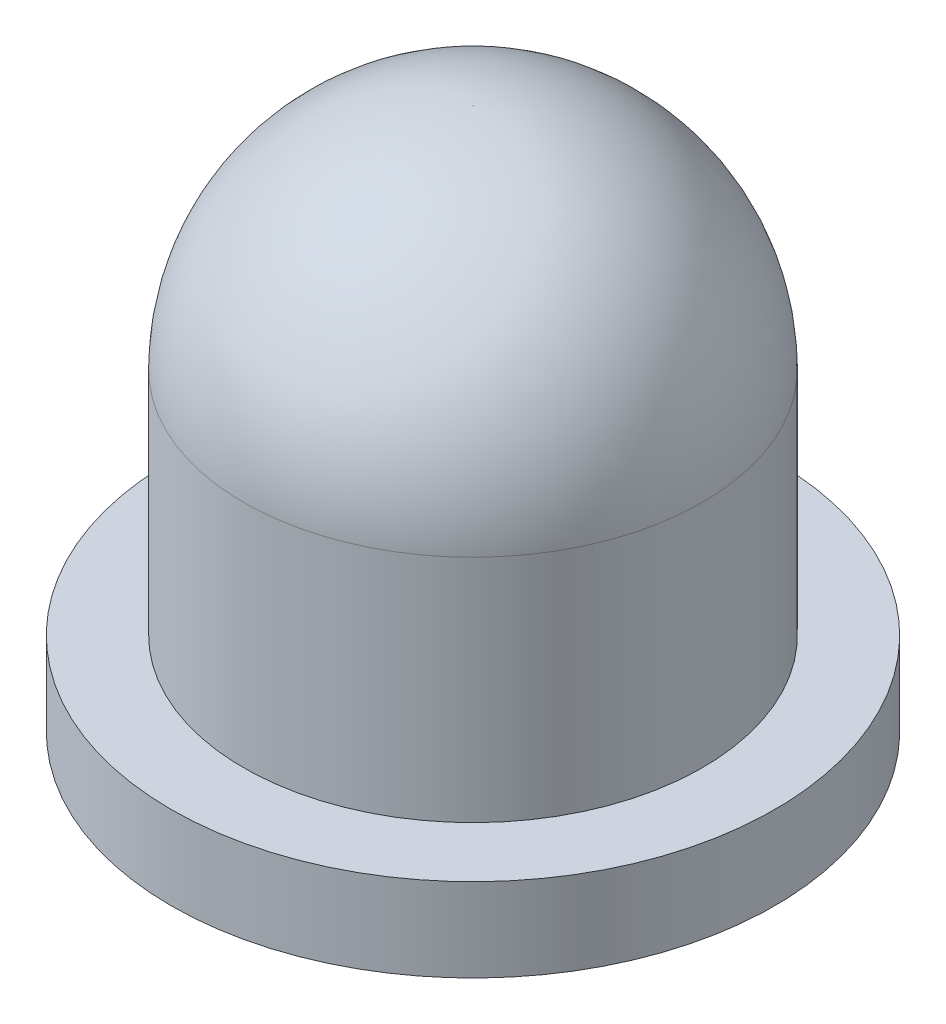
from build123d import *

# Parameters (mm, degrees)
CROQUIS2_R              = 7.234376708
SALIENTE_EXTRUIR1_DEPTH = 2


with BuildPart() as part:
    # Croquis1 → Revolución1 (revolve)
    with BuildSketch(Plane.XY, mode=Mode.PRIVATE) as revoluci_n1_sk:
        with BuildLine():
            Line((2.75, -5.5), (2.75, 0.01))
            ThreePointArc((2.75, 0.01), (1.142016229, 3.892016229), (-2.74, 5.5))
            Line((-2.74, 5.5), (-2.75, 5.5))
            Line((-2.75, 5.5), (-2.75, -5.5))
            Line((-2.75, -5.5), (2.75, -5.5))
        make_face()
    revolve(revoluci_n1_sk.sketch.rotate(Axis((-2.75, -5.5, 0), (0, 1, 0)), 90), axis=Axis((-2.75, -5.5, 0), (0, 1, 0)))

    # Croquis2 → Saliente-Extruir1 (add)
    with BuildSketch(Plane.XZ.offset(5.5)):
        with Locations(Location((-2.75, 0, 0), (0, 0, 270))):
            Circle(CROQUIS2_R)
    extrude(amount=SALIENTE_EXTRUIR1_DEPTH)


solid = part.part
